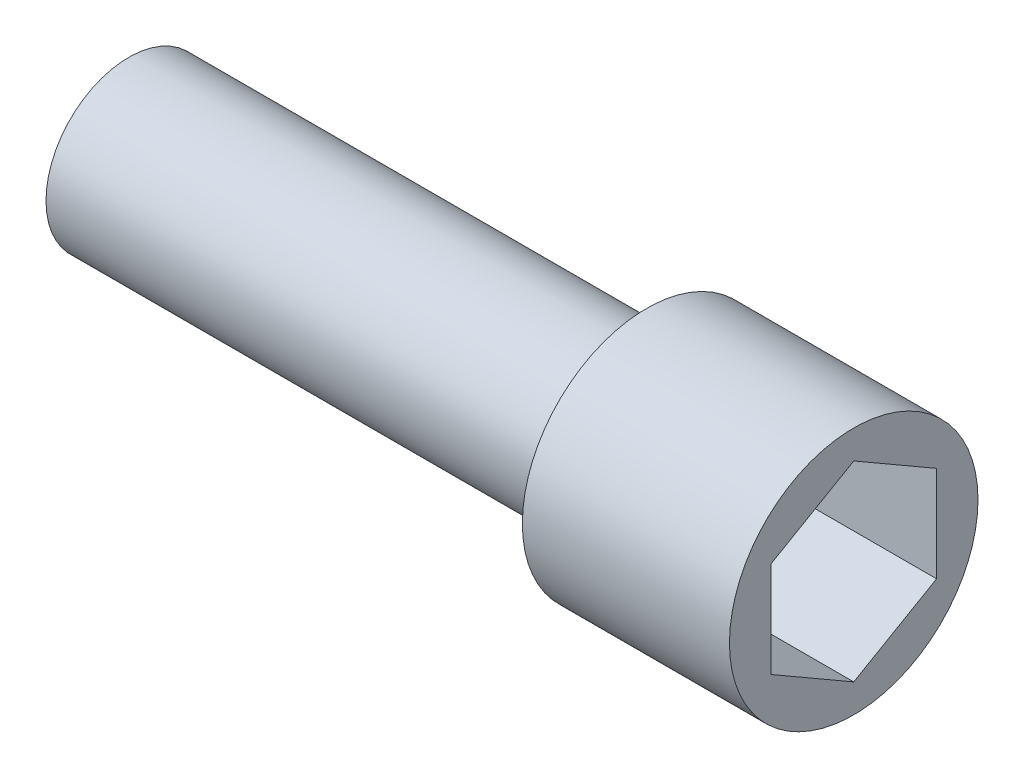
from build123d import *

# Parameters (mm, degrees)
SKETCH1_R           = 6
BOSS_EXTRUDE1_DEPTH = 10
CUT_EXTRUDE1_DEPTH  = 7
SKETCH3_R           = 4
BOSS_EXTRUDE2_DEPTH = 25


with BuildPart() as part:
    # Sketch1 → Boss-Extrude1 (new body)
    with BuildSketch(Plane.YZ):
        with Locations(Location((0, 0, 0), (0, 0, 270))):
            Circle(SKETCH1_R)
    extrude(amount=BOSS_EXTRUDE1_DEPTH)

    # Sketch2 → Cut-Extrude1 (cut)
    with BuildSketch(Plane.YZ.offset(10)):
        Polygon((4.618802154, 0), (2.309401077, 4), (-2.309401077, 4), (-4.618802154, 0), (-2.309401077, -4), (2.309401077, -4), align=None)
    extrude(amount=-CUT_EXTRUDE1_DEPTH, mode=Mode.SUBTRACT)

    # Sketch3 → Boss-Extrude2 (add)
    with BuildSketch(Plane(origin=(0, 0, 0), x_dir=(0, -1, 0), z_dir=(-1, 0, 0))):
        with Locations(Location((0, 0, 0), (0, 0, 90))):
            Circle(SKETCH3_R)
    extrude(amount=BOSS_EXTRUDE2_DEPTH)


solid = part.part
